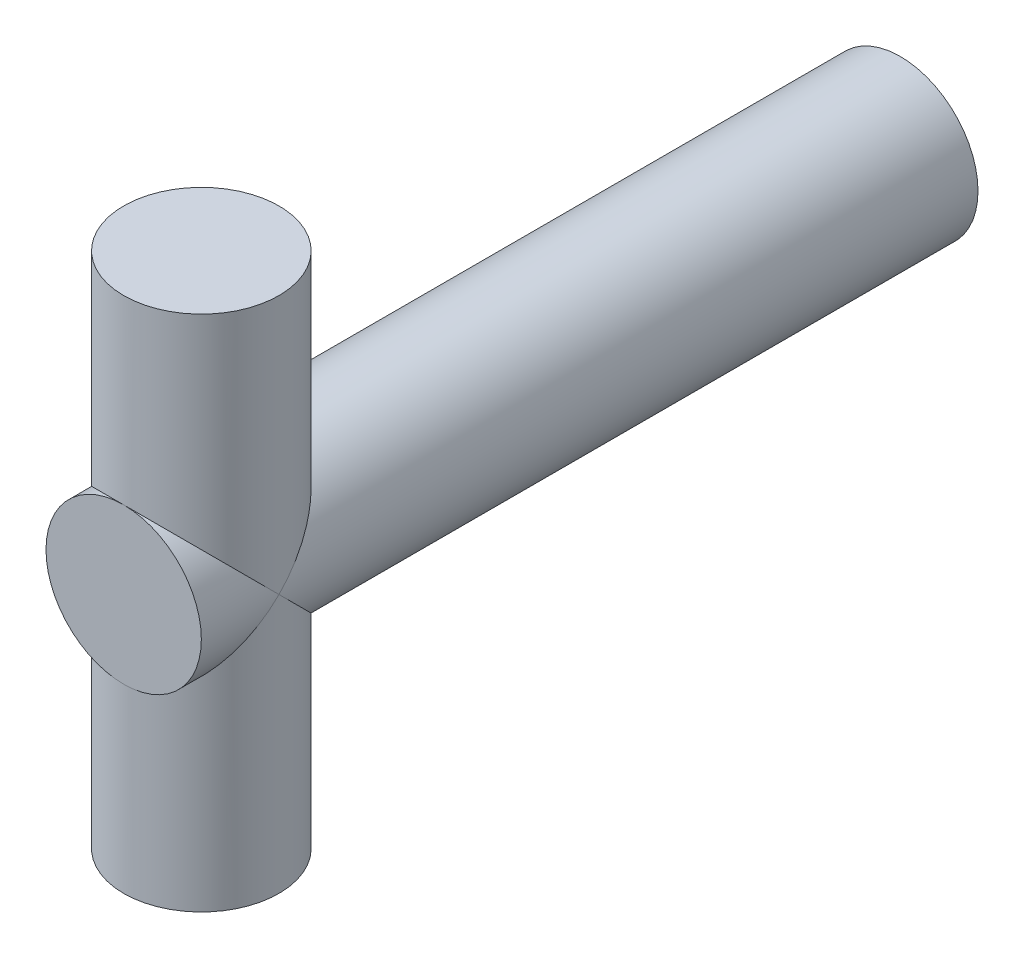
from build123d import *

# Parameters (mm, degrees)
SKETCH1_R                = 1.5
BOSS_EXTRUDE1_DEPTH      = 15
BOSS_EXTRUDE2_DEPTH      = 5
BOSS_EXTRUDE2_DEPTH_BACK = 5
SKETCH2_R                = 1.5


with BuildPart() as part:
    # Sketch1 → Boss-Extrude1 (new body)
    with BuildSketch(Plane.XY):
        Circle(SKETCH1_R)
    extrude(amount=BOSS_EXTRUDE1_DEPTH)

    # Sketch2 → Boss-Extrude2 (add, two sides: drawn at the far end of the back side and taken through both)
    with BuildSketch(Plane(origin=(0, 0, 0), x_dir=(1, 0, 0), z_dir=(0, 1, 0)).offset(-BOSS_EXTRUDE2_DEPTH_BACK)):
        with Locations((0, -13.5)):
            Circle(SKETCH2_R)
    extrude(amount=BOSS_EXTRUDE2_DEPTH + BOSS_EXTRUDE2_DEPTH_BACK)


solid = part.part
